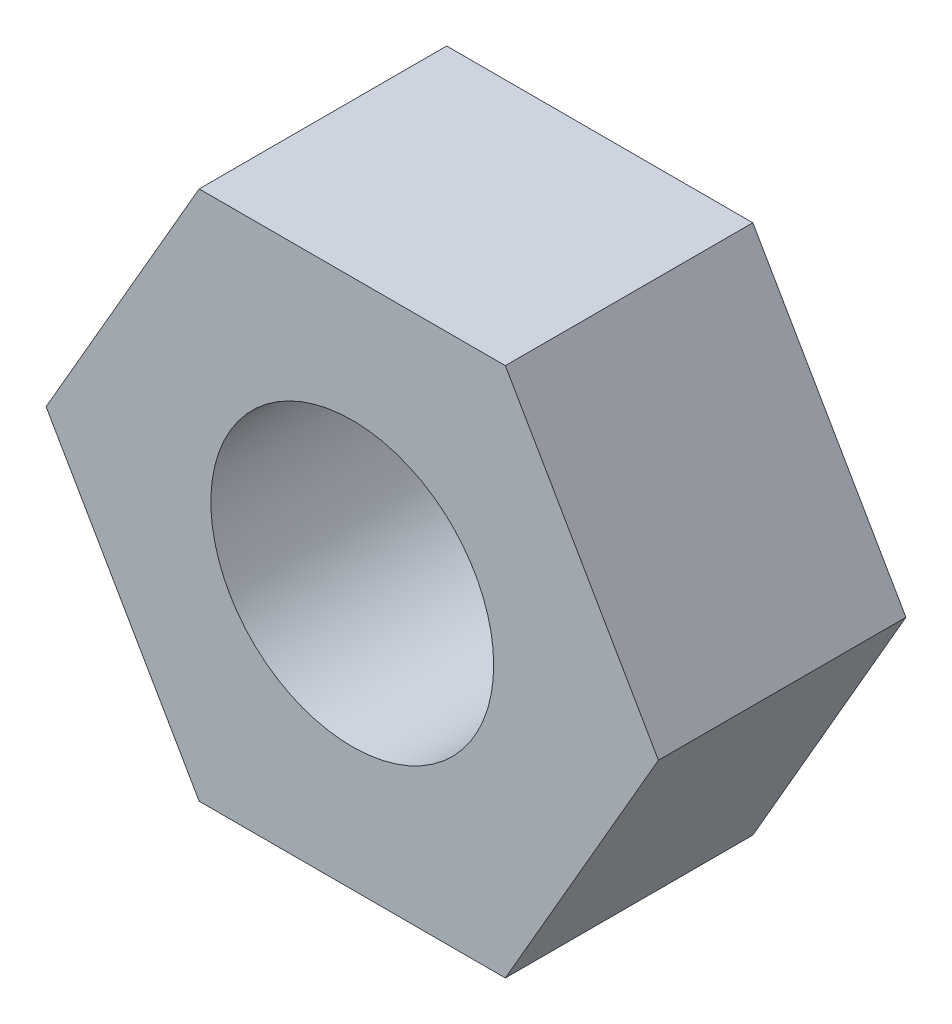
from build123d import *

# Parameters (mm, degrees)
CROQUIS1_R              = 4
SALIENTE_EXTRUIR2_DEPTH = 7


with BuildPart() as part:
    # Croquis1 → Saliente-Extruir2 (new body)
    with BuildSketch(Plane.XY):
        Polygon((-4.330127019, -7.5), (4.330127019, -7.5), (8.660254038, 0), (4.330127019, 7.5), (-4.330127019, 7.5), (-8.660254038, 0), align=None)
        Circle(CROQUIS1_R, mode=Mode.SUBTRACT)
    extrude(amount=SALIENTE_EXTRUIR2_DEPTH)


solid = part.part
